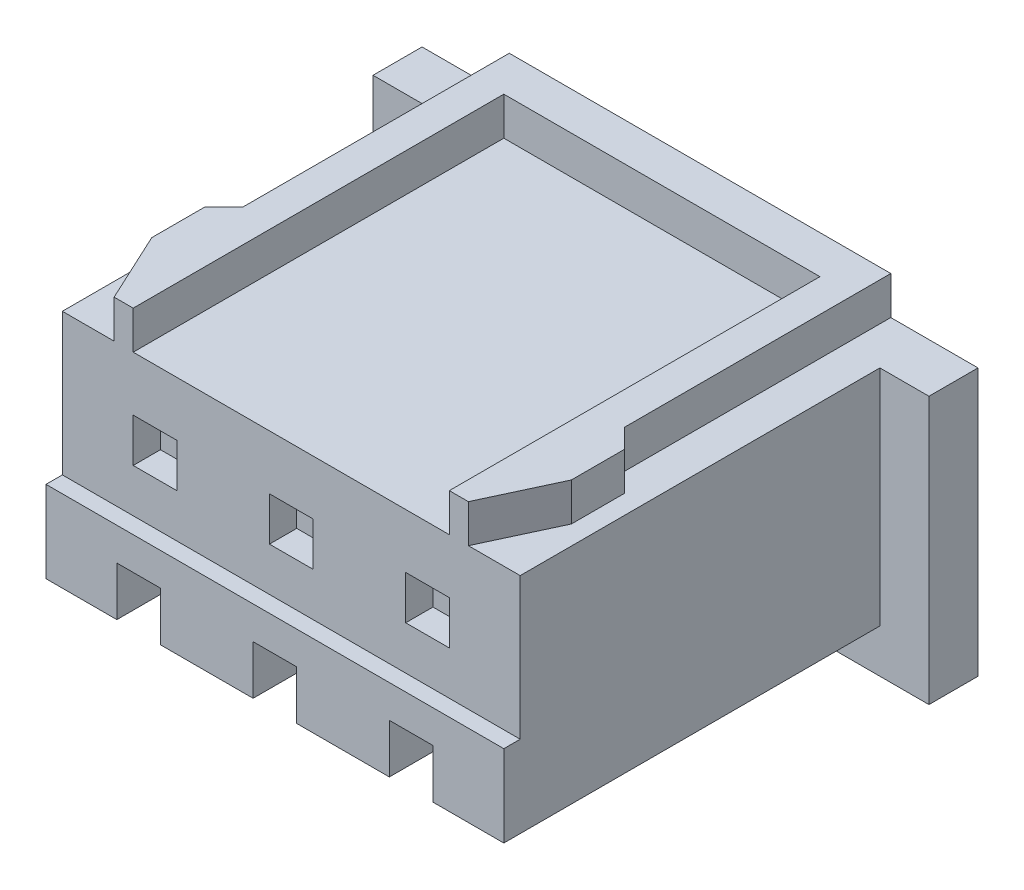
from build123d import *

# Parameters (mm, degrees)
ESQUISSE1_W             = 10.2
ESQUISSE1_H             = 5.6
BOSS_EXTRU_1_DEPTH      = 7.8
ESQUISSE2_W             = 10.2
ESQUISSE2_H             = 3.3
ENL_V_MAT_EXTRU_1_DEPTH = 0.3
ESQUISSE4_W             = 0.9
ESQUISSE4_H             = 3.3
ENL_V_MAT_EXTRU_2_DEPTH = 6.9
ESQUISSE5_W             = 2.9
ESQUISSE5_H             = 6.8
ENL_V_MAT_EXTRU_3_DEPTH = 0.7
ESQUISSE6_W             = 0.8
ESQUISSE6_H             = 0.9
ENL_V_MAT_EXTRU_4_DEPTH = 0.8
ESQUISSE7_W             = 0.8
ESQUISSE7_H             = 0.8
ENL_V_MAT_EXTRU_5_DEPTH = 0.5
ENL_V_MAT_EXTRU_6_DEPTH = 7
ENL_V_MAT_EXTRU_7_DEPTH = 0.8
ESQUISSE10_R            = 0.6
ENL_V_MAT_EXTRU_8_DEPTH = 0.5
ESQUISSE11_W            = 0.8
ESQUISSE11_H            = 0.3
ENL_V_MAT_EXTRU_9_DEPTH = 2.2


with BuildPart() as part:
    # Esquisse1 → Boss.-Extru.1 (new body)
    with BuildSketch(Plane.XY):
        Rectangle(ESQUISSE1_W, ESQUISSE1_H)
    extrude(amount=-BOSS_EXTRU_1_DEPTH)

    # Esquisse2 → Enlèv. mat.-Extru.1 (cut)
    with BuildSketch(Plane.XY):
        with Locations((0, 1.15)):
            Rectangle(ESQUISSE2_W, ESQUISSE2_H)
    extrude(amount=-ENL_V_MAT_EXTRU_1_DEPTH, mode=Mode.SUBTRACT)

    # Esquisse4 → Enlèv. mat.-Extru.2 (cut)
    with BuildSketch(Plane.XY):
        with Locations((-4.65, 1.15)):
            Rectangle(ESQUISSE4_W, ESQUISSE4_H)
        Polygon((5.1, -2.8), (5.1, -0.5), (4.2, -0.5), (4.2, -2), (-4.2, -2), (-4.2, -0.5), (-5.1, -0.5), (-5.1, -2.8), align=None)
        with Locations((4.65, 1.15)):
            Rectangle(ESQUISSE4_W, ESQUISSE4_H)
    extrude(amount=-ENL_V_MAT_EXTRU_2_DEPTH, mode=Mode.SUBTRACT)

    # Esquisse5 → Enlèv. mat.-Extru.3 (cut)
    with BuildSketch(Plane(origin=(0, 2.8, 0), x_dir=(1, 0, 0), z_dir=(0, 1, 0))):
        with Locations((-1.45, 3.7)):
            Rectangle(ESQUISSE5_W, ESQUISSE5_H)
        with Locations((1.45, 3.7)):
            Rectangle(ESQUISSE5_W, ESQUISSE5_H)
        Polygon((5.1, 7.8), (3.5, 7.8), (3.5, 2.91), (3.85, 2.56), (3.85, 1.59), (3.25, 0.3), (4.2, 0.3), (4.2, 6.9), (5.1, 6.9), align=None)
        Polygon((-3.5, 2.91), (-3.5, 7.8), (-5.1, 7.8), (-5.1, 6.9), (-4.2, 6.9), (-4.2, 0.3), (-3.25, 0.3), (-3.85, 1.59), (-3.85, 2.56), align=None)
    extrude(amount=-ENL_V_MAT_EXTRU_3_DEPTH, mode=Mode.SUBTRACT)

    # Esquisse6 → Enlèv. mat.-Extru.4 (cut)
    with BuildSketch(Plane.XY):
        with Locations((-2.5, -1.55)):
            Rectangle(ESQUISSE6_W, ESQUISSE6_H)
        with Locations((0, -1.55)):
            Rectangle(ESQUISSE6_W, ESQUISSE6_H)
        with Locations((2.5, -1.55)):
            Rectangle(ESQUISSE6_W, ESQUISSE6_H)
    extrude(amount=-ENL_V_MAT_EXTRU_4_DEPTH, mode=Mode.SUBTRACT)

    # Esquisse7 → Enlèv. mat.-Extru.5 (cut)
    with BuildSketch(Plane.XY.offset(-0.3)):
        with Locations((-2.5, 0.7)):
            Rectangle(ESQUISSE7_W, ESQUISSE7_H)
        with Locations((0, 0.7)):
            Rectangle(ESQUISSE7_W, ESQUISSE7_H)
        with Locations((2.5, 0.7)):
            Rectangle(ESQUISSE7_W, ESQUISSE7_H)
    extrude(amount=-ENL_V_MAT_EXTRU_5_DEPTH, mode=Mode.SUBTRACT)

    # Esquisse8 → Enlèv. mat.-Extru.6 (cut)
    # profile 1 of 3: a face of its own
    with BuildSketch(Plane(origin=(0, 0, -7.8), x_dir=(-1, 0, 0), z_dir=(0, 0, -1))):
        Polygon((0.4, -1.5), (0.8, -1.5), (0.8, 1.5), (-0.8, 1.5), (-0.8, -1.5), (-0.4, -1.5), (-0.4, -1.7), (0.4, -1.7), align=None)
        with BuildLine():
            ThreePointArc((-0.7, 0.95), (-0.35, 1.3), (0, 0.95))
            ThreePointArc((0, 0.95), (0.35, 1.3), (0.7, 0.95))
            Line((0.7, 0.95), (0.7, -1.45))
            Line((0.7, -1.45), (-0.7, -1.45))
            Line((-0.7, -1.45), (-0.7, 0.95))
        make_face(mode=Mode.SUBTRACT)
    # profile 2 of 3: a face of its own
    with BuildSketch(Plane(origin=(0, 0, -7.8), x_dir=(-1, 0, 0), z_dir=(0, 0, -1))):
        Polygon((-2.1, -1.5), (-1.7, -1.5), (-1.7, 1.5), (-3.3, 1.5), (-3.3, -1.5), (-2.9, -1.5), (-2.9, -1.7), (-2.1, -1.7), align=None)
        with BuildLine():
            ThreePointArc((-3.2, 0.95), (-2.85, 1.3), (-2.5, 0.95))
            ThreePointArc((-2.5, 0.95), (-2.15, 1.3), (-1.8, 0.95))
            Line((-1.8, 0.95), (-1.8, -1.45))
            Line((-1.8, -1.45), (-3.2, -1.45))
            Line((-3.2, -1.45), (-3.2, 0.95))
        make_face(mode=Mode.SUBTRACT)
    # profile 3 of 3: a face of its own
    with BuildSketch(Plane(origin=(0, 0, -7.8), x_dir=(-1, 0, 0), z_dir=(0, 0, -1))):
        Polygon((2.9, -1.5), (3.3, -1.5), (3.3, 1.5), (1.7, 1.5), (1.7, -1.5), (2.1, -1.5), (2.1, -1.7), (2.9, -1.7), align=None)
        with BuildLine():
            ThreePointArc((1.8, 0.95), (2.15, 1.3), (2.5, 0.95))
            ThreePointArc((2.5, 0.95), (2.85, 1.3), (3.2, 0.95))
            Line((3.2, 0.95), (3.2, -1.45))
            Line((3.2, -1.45), (1.8, -1.45))
            Line((1.8, -1.45), (1.8, 0.95))
        make_face(mode=Mode.SUBTRACT)
    extrude(amount=-ENL_V_MAT_EXTRU_6_DEPTH, mode=Mode.SUBTRACT)

    # Esquisse9 → Enlèv. mat.-Extru.7 (cut)
    with BuildSketch(Plane(origin=(0, 0, -7.8), x_dir=(-1, 0, 0), z_dir=(0, 0, -1))):
        with BuildLine():
            Line((-0.7, 0.95), (-0.7, -1.45))
            Line((-0.7, -1.45), (0.7, -1.45))
            Line((0.7, -1.45), (0.7, 0.95))
            ThreePointArc((0.7, 0.95), (0.35, 1.3), (0, 0.95))
            ThreePointArc((0, 0.95), (-0.35, 1.3), (-0.7, 0.95))
        make_face()
        with BuildLine():
            Line((-3.2, 0.95), (-3.2, -1.45))
            Line((-3.2, -1.45), (-1.8, -1.45))
            Line((-1.8, -1.45), (-1.8, 0.95))
            ThreePointArc((-1.8, 0.95), (-2.15, 1.3), (-2.5, 0.95))
            ThreePointArc((-2.5, 0.95), (-2.85, 1.3), (-3.2, 0.95))
        make_face()
        with BuildLine():
            Line((1.8, 0.95), (1.8, -1.45))
            Line((1.8, -1.45), (3.2, -1.45))
            Line((3.2, -1.45), (3.2, 0.95))
            ThreePointArc((3.2, 0.95), (2.85, 1.3), (2.5, 0.95))
            ThreePointArc((2.5, 0.95), (2.15, 1.3), (1.8, 0.95))
        make_face()
    extrude(amount=-ENL_V_MAT_EXTRU_7_DEPTH, mode=Mode.SUBTRACT)

    # Esquisse10 → Enlèv. mat.-Extru.8 (cut)
    with BuildSketch(Plane(origin=(0, 0, -7), x_dir=(-1, 0, 0), z_dir=(0, 0, -1))):
        Circle(ESQUISSE10_R)
        with Locations((-2.5, 0)):
            Circle(ESQUISSE10_R)
        with Locations((2.5, 0)):
            Circle(ESQUISSE10_R)
    extrude(amount=-ENL_V_MAT_EXTRU_8_DEPTH, mode=Mode.SUBTRACT)

    # Esquisse11 → Enlèv. mat.-Extru.9 (cut)
    with BuildSketch(Plane.XY.offset(-0.8)):
        with Locations((-2.5, -1.85)):
            Rectangle(ESQUISSE11_W, ESQUISSE11_H)
        with Locations((0, -1.85)):
            Rectangle(ESQUISSE11_W, ESQUISSE11_H)
        with Locations((2.5, -1.85)):
            Rectangle(ESQUISSE11_W, ESQUISSE11_H)
    extrude(amount=-ENL_V_MAT_EXTRU_9_DEPTH, mode=Mode.SUBTRACT)


solid = part.part
